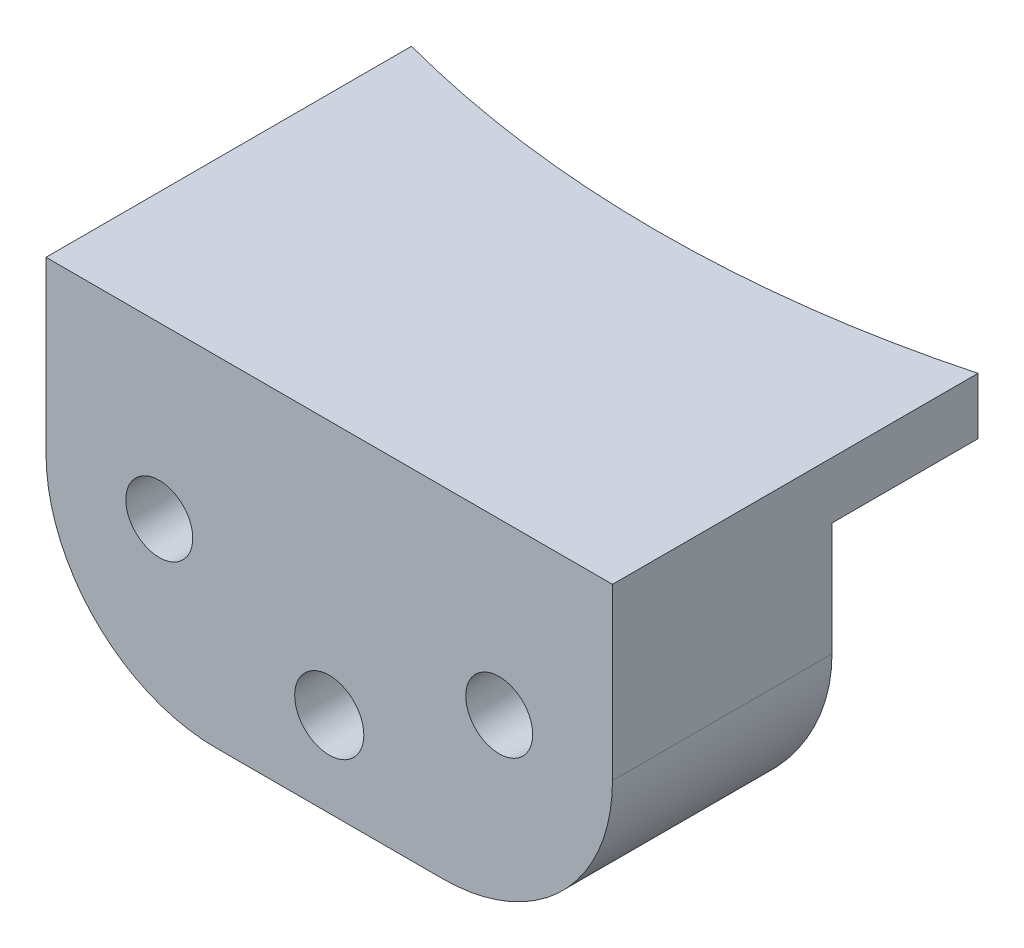
from build123d import *
from build123d.topology import SkipClean

# Parameters (mm, degrees)
BOSS_EXTRUDE1_DEPTH = 12.7
SKETCH2_R           = 1.500000048
CUT_EXTRUDE1_DEPTH  = 58.854101994
FILLET1_R           = 7.62
CUT_EXTRUDE2_DEPTH  = 62.533611452
BOSS_EXTRUDE2_DEPTH = 2.54
SKETCH8_R           = 1.500000048
SKETCH8_R_2         = 1.549999948
BOSS_EXTRUDE3_DEPTH = 5.08


with BuildPart() as part:
    # Sketch1 → Boss-Extrude1 (new body)
    with BuildSketch(Plane(origin=(0, 0, 0), x_dir=(1, 0, 0), z_dir=(0, 1, 0))):
        with BuildLine():
            ThreePointArc((12.7, -54.091601994), (0, -55.5625), (-12.7, -54.091601994))
            Line((-12.7, -54.091601994), (-12.7, -58.854101994))
            Line((-12.7, -58.854101994), (12.7, -58.854101994))
            Line((12.7, -58.854101994), (12.7, -54.091601994))
        make_face()
    extrude(amount=BOSS_EXTRUDE1_DEPTH)

    # Sketch2 → Cut-Extrude1 (cut)
    with BuildSketch(Plane.XY):
        with Locations(Location((-7.62, 7.62, 0), (0, 0, 180))):
            Circle(SKETCH2_R)
    cut_extrude1 = extrude(amount=CUT_EXTRUDE1_DEPTH, mode=Mode.SUBTRACT)

    # Mirror1: Cut-Extrude1 across plane
    add(cut_extrude1.mirror(Plane(origin=(0, 0, 0), x_dir=(0, 0, 1), z_dir=(1, 0, 0))), mode=Mode.SUBTRACT)

    # Fillet1
    fillet1_edges = [part.edges().sort_by_distance(p)[0] for p in [
        (-12.7, 0, 56.472851994),
        (12.7, 0, 56.472851994),
    ]]
    fillet(fillet1_edges, radius=FILLET1_R)

    # Sketch2<4> → Cut-Extrude2 (cut, through all)
    with BuildSketch(Plane.XY):
        with BuildLine():
            ThreePointArc((1.549999948, 3.81), (1.096015474, 4.906015474), (0, 5.359999948))
            Line((0, 5.359999948), (0, 2.260000052))
            ThreePointArc((0, 2.260000052), (1.096015474, 2.713984526), (1.549999948, 3.81))
        make_face()
        with BuildLine():
            Line((0, 2.260000052), (0, 5.359999948))
            ThreePointArc((0, 5.359999948), (-1.549999948, 3.81), (0, 2.260000052))
        make_face()
    extrude(amount=CUT_EXTRUDE2_DEPTH, mode=Mode.SUBTRACT)

    # Sketch7 → Boss-Extrude2 (add)
    with BuildSketch(Plane(origin=(0, 12.7, 0), x_dir=(1, 0, 0), z_dir=(0, 1, 0))):
        with BuildLine():
            Line((-12.7, -54.091601994), (-12.7, -58.854101994))
            Line((-12.7, -58.854101994), (12.7, -58.854101994))
            Line((12.7, -58.854101994), (12.7, -54.091601994))
            ThreePointArc((12.7, -54.091601994), (0, -55.5625), (-12.7, -54.091601994))
        make_face()
        with BuildLine():
            ThreePointArc((-12.7, -47.545558744), (0, -49.2125), (12.7, -47.545558744))
            Line((12.7, -47.545558744), (12.7, -54.091601994))
            ThreePointArc((12.7, -54.091601994), (0, -55.5625), (-12.7, -54.091601994))
            Line((-12.7, -54.091601994), (-12.7, -47.545558744))
        make_face()
    extrude(amount=BOSS_EXTRUDE2_DEPTH)

    # Sketch8 → Boss-Extrude3 (add)
    with SkipClean():  # the faces are left unmerged after this step: merging them gives an invalid solid
        with BuildSketch(Plane.XY.offset(58.854101994)):
            with BuildLine():
                Line((-5.08, 0), (5.08, 0))
                ThreePointArc((5.08, 0), (10.468153673, 2.231846327), (12.7, 7.62))
                Line((12.7, 7.62), (12.7, 15.24))
                Line((12.7, 15.24), (-12.7, 15.24))
                Line((-12.7, 15.24), (-12.7, 7.62))
                ThreePointArc((-12.7, 7.62), (-10.468153673, 2.231846327), (-5.08, 0))
            make_face()
            with Locations(Location((7.62, 7.62, 0), (0, 0, 180))):
                Circle(SKETCH8_R, mode=Mode.SUBTRACT)
            with Locations(Location((0, 3.81, 0), (0, 0, 180))):
                Circle(SKETCH8_R_2, mode=Mode.SUBTRACT)
            with Locations(Location((-7.62, 7.62, 0), (0, 0, 180))):
                Circle(SKETCH8_R, mode=Mode.SUBTRACT)
        extrude(amount=BOSS_EXTRUDE3_DEPTH)


solid = part.part
